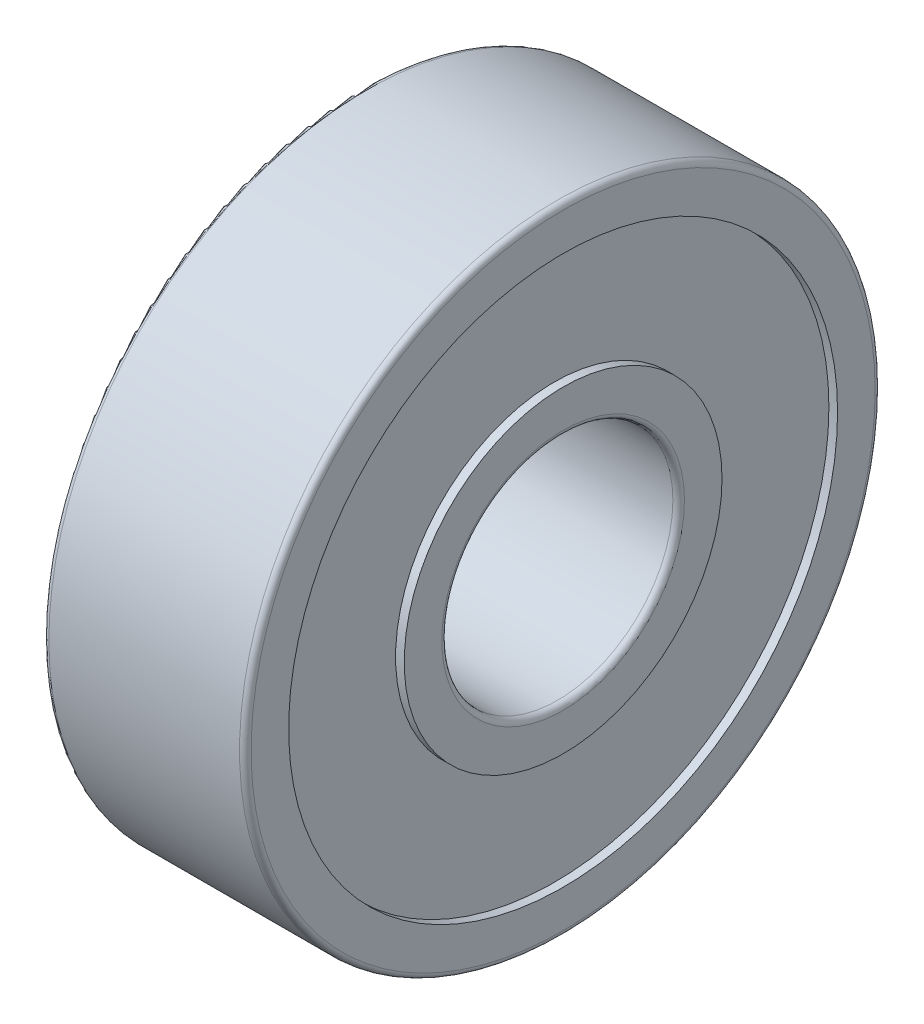
from build123d import *

# Parameters (mm, degrees)
FILLET1_R = 0.2


with BuildPart() as part:
    # Sketch1 → Revolve1 (revolve)
    with BuildSketch(Plane.XY, mode=Mode.PRIVATE) as revolve1_sk:
        Polygon((3.5, 4), (-3.5, 4), (-3.5, 5.5), (-3.2, 5.5), (-3.2, 9.5), (-3.5, 9.5), (-3.5, 11), (3.5, 11), (3.5, 9.5), (3.2, 9.5), (3.2, 5.5), (3.5, 5.5), align=None)
    revolve(revolve1_sk.sketch.rotate(Axis((0, 0, 0), (-1, 0, 0)), 90), axis=Axis((0, 0, 0), (-1, 0, 0)))

    # Fillet1
    fillet1_edges = [part.edges().sort_by_distance(p)[0] for p in [
        (3.5, 0, 11),
        (-3.5, 0, 11),
        (-3.5, 0, 4),
        (3.5, 0, 4),
    ]]
    fillet(fillet1_edges, radius=FILLET1_R)


solid = part.part
